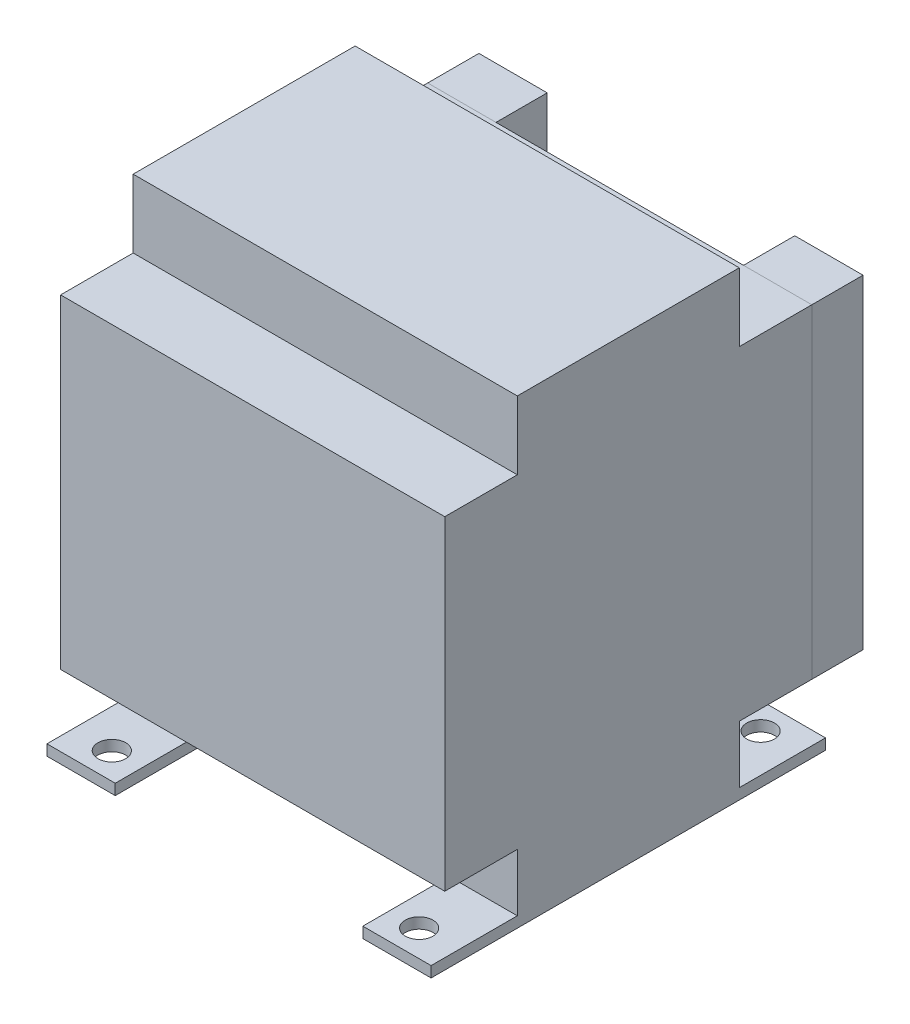
from build123d import *

# Parameters (mm, degrees)
SKETCH2_W             = 71.4375
SKETCH2_H             = 85.725
BOSS_EXTRUDE1_DEPTH   = 20.6375
SKETCH3_W             = 71.4375
SKETCH3_H             = 60.325
BOSS_EXTRUDE2_DEPTH   = 34.13125
SKETCH4_W             = 12.7
SKETCH4_H             = 16.03375
BOSS_EXTRUDE3_DEPTH   = 2
SKETCH5_W             = 12.7
SKETCH5_H             = 60.325
BOSS_EXTRUDE4_DEPTH   = 9.525
BOSS_EXTRUDE4_2_DEPTH = 9.525
SKETCH6_R             = 2.5796875
CUT_EXTRUDE1_DEPTH    = 2
BOSS_EXTRUDE5_DEPTH   = 2


with BuildPart() as part:
    # Sketch2 → Boss-Extrude1 (new, symmetric)
    with BuildSketch(Plane.XY):
        with Locations((35.71875, 42.8625)):
            Rectangle(SKETCH2_W, SKETCH2_H)
    extrude(amount=BOSS_EXTRUDE1_DEPTH, both=True)

    # Sketch3 → Boss-Extrude2 (add, symmetric)
    with BuildSketch(Plane.XY):
        with Locations((35.71875, 42.8625)):
            Rectangle(SKETCH3_W, SKETCH3_H)
    extrude(amount=BOSS_EXTRUDE2_DEPTH, both=True)

    # Sketch4 → Boss-Extrude3 (add)
    with BuildSketch(Plane.XZ):
        with Locations((6.35, 28.654375)):
            Rectangle(SKETCH4_W, SKETCH4_H)
        with Locations((65.0875, 28.654375)):
            Rectangle(SKETCH4_W, SKETCH4_H)
        with Locations((65.0875, -28.654375)):
            Rectangle(SKETCH4_W, SKETCH4_H)
        with Locations((6.35, -28.654375)):
            Rectangle(SKETCH4_W, SKETCH4_H)
    extrude(amount=-BOSS_EXTRUDE3_DEPTH)

    # Sketch6 → Cut-Extrude1 (cut)
    with BuildSketch(Plane.XZ):
        with Locations(Location((7.14375, 31.75, 0), (0, 0, 270))):
            Circle(SKETCH6_R)
        with Locations(Location((64.29375, 31.75, 0), (0, 0, 270))):
            Circle(SKETCH6_R)
        with Locations(Location((64.29375, -31.75, 0), (0, 0, 270))):
            Circle(SKETCH6_R)
        with Locations(Location((7.14375, -31.75, 0), (0, 0, 270))):
            Circle(SKETCH6_R)
    extrude(amount=-CUT_EXTRUDE1_DEPTH, mode=Mode.SUBTRACT)


with BuildPart() as body_2:
    # Sketch5 → Boss-Extrude4 (new body)
    with BuildSketch(Plane(origin=(0, 0, -34.13125), x_dir=(-1, 0, 0), z_dir=(0, 0, -1))):
        with Locations((-65.0875, 42.8625)):
            Rectangle(SKETCH5_W, SKETCH5_H)
    extrude(amount=BOSS_EXTRUDE4_DEPTH)


with BuildPart() as body_3:
    # Sketch5 → Boss-Extrude4 2 (new body)
    with BuildSketch(Plane(origin=(0, 0, -34.13125), x_dir=(-1, 0, 0), z_dir=(0, 0, -1))):
        with Locations((-6.35, 42.8625)):
            Rectangle(SKETCH5_W, SKETCH5_H)
    extrude(amount=BOSS_EXTRUDE4_2_DEPTH)


with BuildPart() as body_4:
    # Sketch7 → Boss-Extrude5 (new body)
    with BuildSketch(Plane.XZ):
        with BuildLine():
            ThreePointArc((23.01875, -44.45), (16.66875, -38.1), (23.01875, -31.75))
            Line((23.01875, -31.75), (48.41875, -31.75))
            ThreePointArc((48.41875, -31.75), (54.76875, -38.1), (48.41875, -44.45))
            Line((48.41875, -44.45), (23.01875, -44.45))
        make_face()
    extrude(amount=BOSS_EXTRUDE5_DEPTH)


solid = Compound([part.part, body_2.part, body_3.part, body_4.part])
